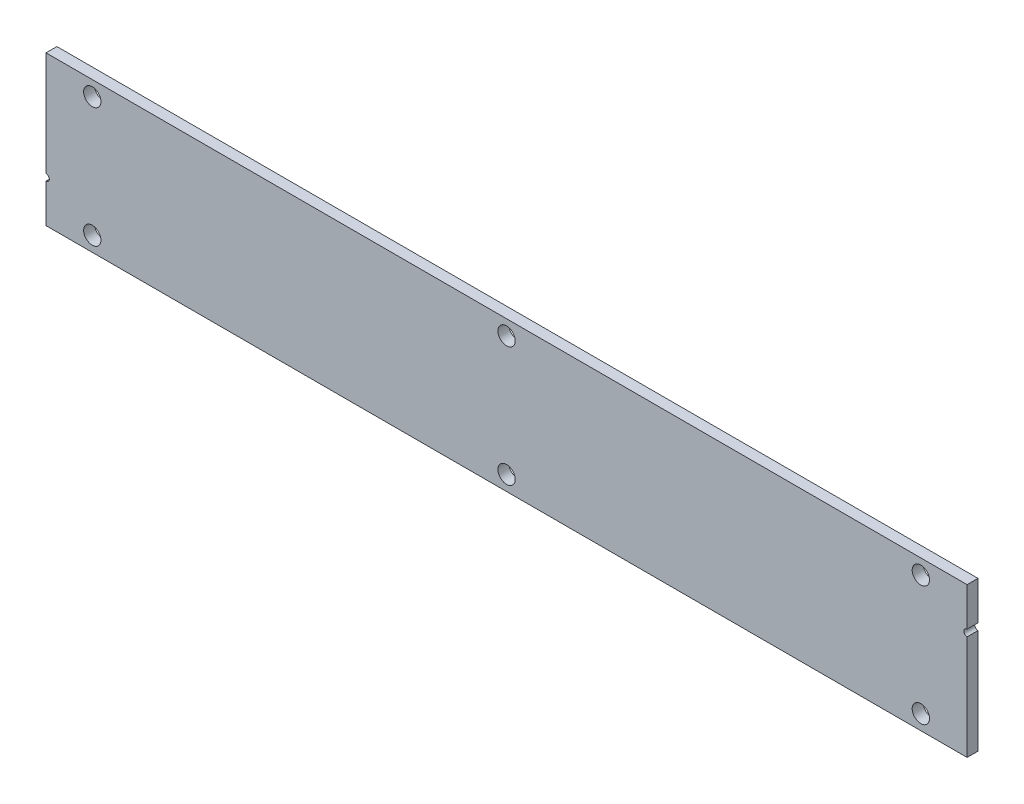
from build123d import *

# Parameters (mm, degrees)
SKETCH1_R           = 1.3125
BOSS_EXTRUDE1_DEPTH = 1.651


with BuildPart() as part:
    # Sketch1 → Boss-Extrude1 (new body)
    with BuildSketch(Plane.XY):
        with BuildLine():
            Line((-69.85, -5.5), (-69.85, -11.35))
            Line((-69.85, -11.35), (69.85, -11.35))
            Line((69.85, -11.35), (69.85, 4.5))
            ThreePointArc((69.85, 4.5), (69.35, 5), (69.85, 5.5))
            Line((69.85, 5.5), (69.85, 11.35))
            Line((69.85, 11.35), (-69.85, 11.35))
            Line((-69.85, 11.35), (-69.85, -4.5))
            ThreePointArc((-69.85, -4.5), (-69.496446609, -4.646446609), (-69.35, -5))
            ThreePointArc((-69.35, -5), (-69.496446609, -5.353553391), (-69.85, -5.5))
        make_face()
        with Locations(Location((-62.83, -9.1, 0), (0, 0, 180))):
            Circle(SKETCH1_R, mode=Mode.SUBTRACT)
        with Locations(Location((0, -9.1, 0), (0, 0, 180))):
            Circle(SKETCH1_R, mode=Mode.SUBTRACT)
        with Locations(Location((62.83, -9.1, 0), (0, 0, 180))):
            Circle(SKETCH1_R, mode=Mode.SUBTRACT)
        with Locations(Location((-62.83, 9.1, 0), (0, 0, 180))):
            Circle(SKETCH1_R, mode=Mode.SUBTRACT)
        with Locations(Location((0, 9.1, 0), (0, 0, 180))):
            Circle(SKETCH1_R, mode=Mode.SUBTRACT)
        with Locations(Location((62.83, 9.1, 0), (0, 0, 180))):
            Circle(SKETCH1_R, mode=Mode.SUBTRACT)
    extrude(amount=BOSS_EXTRUDE1_DEPTH)


solid = part.part
